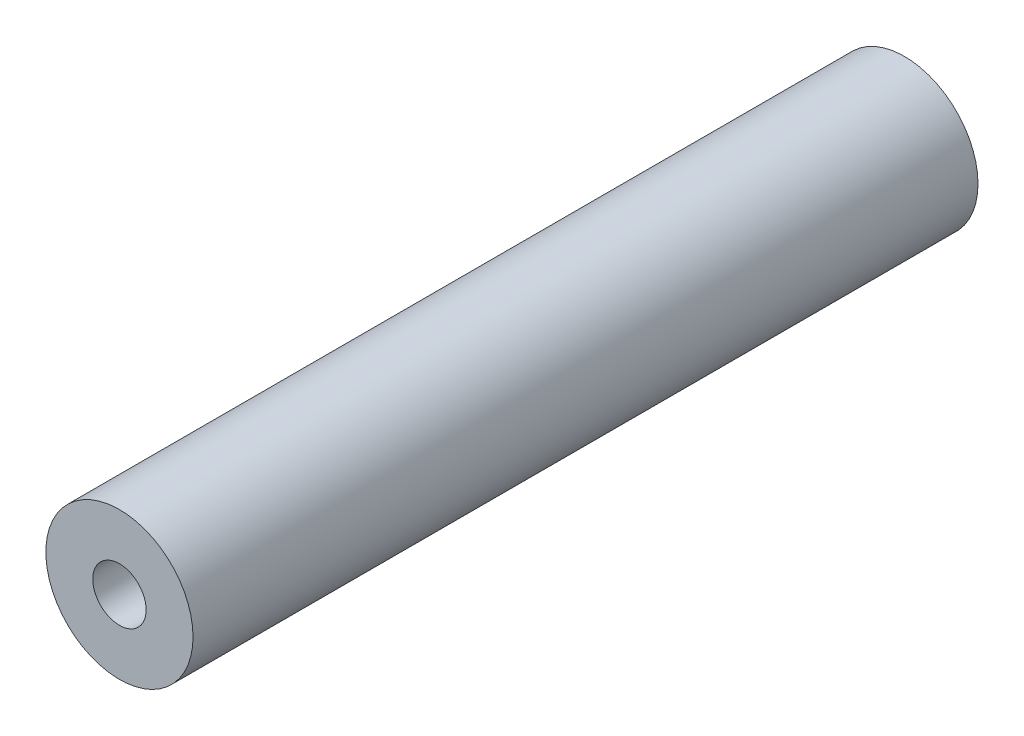
from build123d import *

# Parameters (mm, degrees)
SKETCH1_R                               = 4.7625
BOSS_EXTRUDE1_DEPTH                     = 25.4
TAP_DRILL_FOR_8_32_TAP1_D               = 3.4544
TAP_DRILL_FOR_8_32_TAP1_DEPTH           = 6.35
TAP_DRILL_FOR_8_32_TAP1_TIP             = 1.037806461
TAP_DRILL_FOR_8_32_TAP1_ON_FACE_2_D     = 3.4544
TAP_DRILL_FOR_8_32_TAP1_ON_FACE_2_DEPTH = 6.35
TAP_DRILL_FOR_8_32_TAP1_ON_FACE_2_TIP   = 1.037806461


with BuildPart() as part:
    # Sketch1 → Boss-Extrude1 (new, symmetric)
    with BuildSketch(Plane.XY):
        Circle(SKETCH1_R)
    extrude(amount=BOSS_EXTRUDE1_DEPTH, both=True)

    # Tap Drill for #8-32 Tap1
    with Locations(Plane.XY.offset(25.4)):
        with Locations((0, 0)):
            Hole(TAP_DRILL_FOR_8_32_TAP1_D / 2, depth=TAP_DRILL_FOR_8_32_TAP1_DEPTH)
            with Locations((0, 0, -(TAP_DRILL_FOR_8_32_TAP1_DEPTH + TAP_DRILL_FOR_8_32_TAP1_TIP / 2))):  # 118° drill point
                Cone(0, TAP_DRILL_FOR_8_32_TAP1_D / 2, TAP_DRILL_FOR_8_32_TAP1_TIP, mode=Mode.SUBTRACT)

    # Tap Drill for #8-32 Tap1 on face 2
    with Locations(Plane(origin=(0, 0, -25.4), x_dir=(-1, 0, 0), z_dir=(0, 0, -1))):
        with Locations((0, 0)):
            Hole(TAP_DRILL_FOR_8_32_TAP1_ON_FACE_2_D / 2, depth=TAP_DRILL_FOR_8_32_TAP1_ON_FACE_2_DEPTH)
            with Locations((0, 0, -(TAP_DRILL_FOR_8_32_TAP1_ON_FACE_2_DEPTH + TAP_DRILL_FOR_8_32_TAP1_ON_FACE_2_TIP / 2))):  # 118° drill point
                Cone(0, TAP_DRILL_FOR_8_32_TAP1_ON_FACE_2_D / 2, TAP_DRILL_FOR_8_32_TAP1_ON_FACE_2_TIP, mode=Mode.SUBTRACT)


solid = part.part
